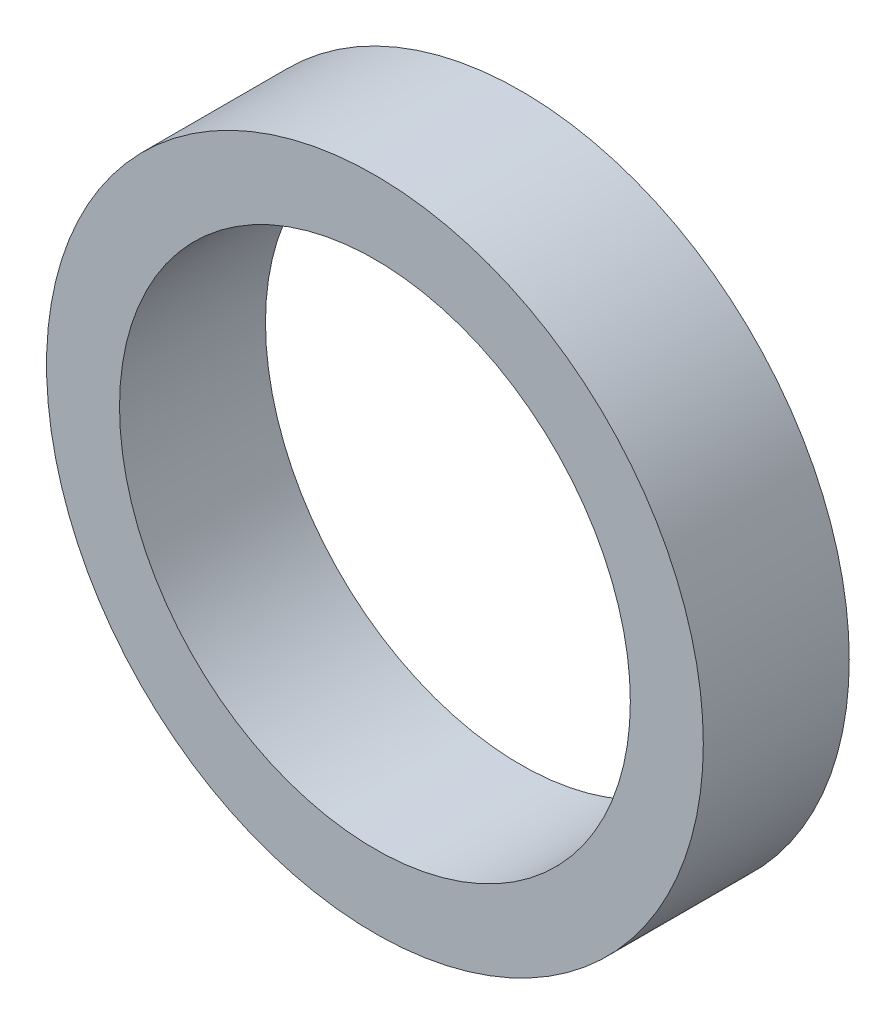
from build123d import *

# Parameters (mm, degrees)
SKETCH_1_R      = 18
SKETCH_1_R_2    = 14
EXTRUDE_1_DEPTH = 8


with BuildPart() as part:
    # Эскиз1 → Бобышка-Вытянуть1 (new body)
    with BuildSketch(Plane.XY):
        Circle(SKETCH_1_R)
        Circle(SKETCH_1_R_2, mode=Mode.SUBTRACT)
    extrude(amount=EXTRUDE_1_DEPTH)


solid = part.part
